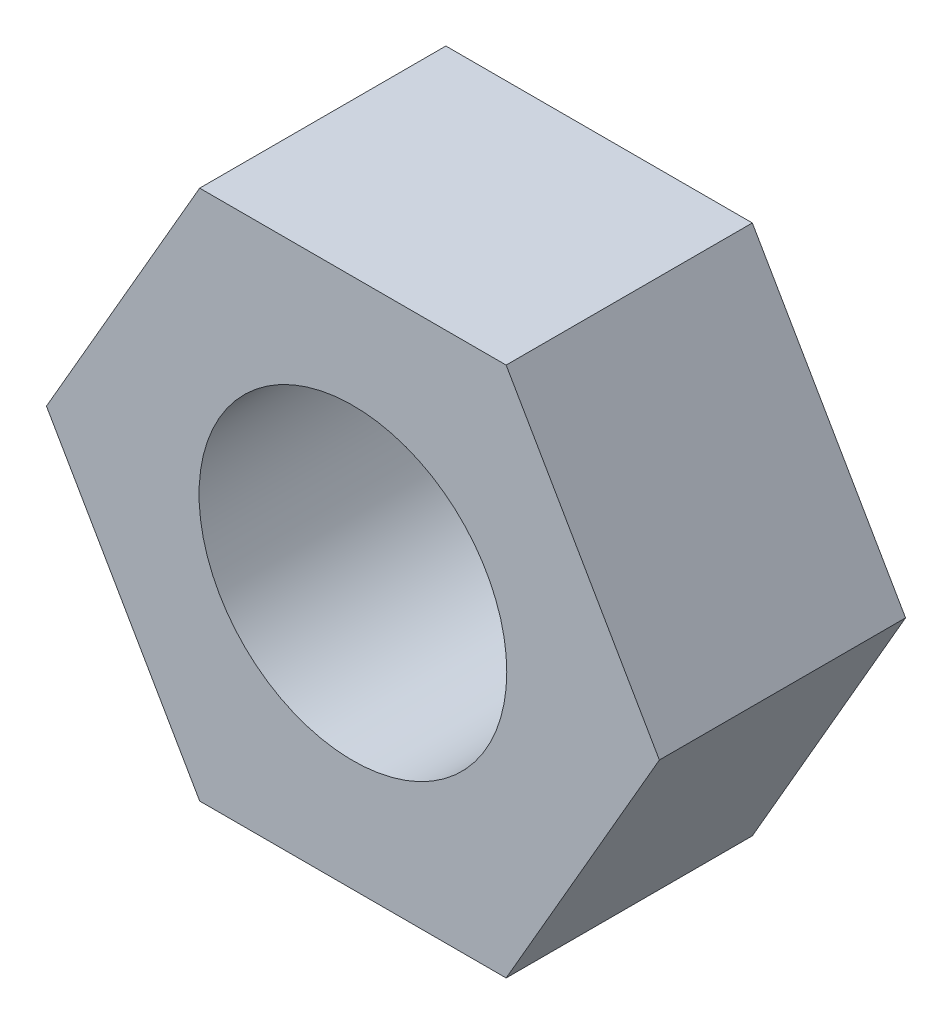
from build123d import *

# Parameters (mm, degrees)
EXTRUDE_1_DEPTH     = 3.2
CUT_EXTRUDE_1_REACH = 8.165
SKETCH_2_R          = 2


with BuildPart() as part:
    # 草图1 → 凸台-拉伸1 (new body)
    with BuildSketch(Plane.XY):
        Polygon((1.991858429, -3.45), (3.983716857, 0), (1.991858429, 3.45), (-1.991858429, 3.45), (-3.983716857, 0), (-1.991858429, -3.45), align=None)
    extrude(amount=EXTRUDE_1_DEPTH)

    # 草图2 → 切除-拉伸1 (cut, up to next)
    with BuildSketch(Plane.XY.offset(3.2), mode=Mode.PRIVATE) as cut_extrude_1_sk1:
        Circle(SKETCH_2_R)
    cut_extrude_1_tool1 = extrude(cut_extrude_1_sk1.sketch, amount=-CUT_EXTRUDE_1_REACH, mode=Mode.PRIVATE) & part.part
    add(cut_extrude_1_tool1.solids().sort_by_distance((0, 0, 3.2))[0], mode=Mode.SUBTRACT)


solid = part.part
